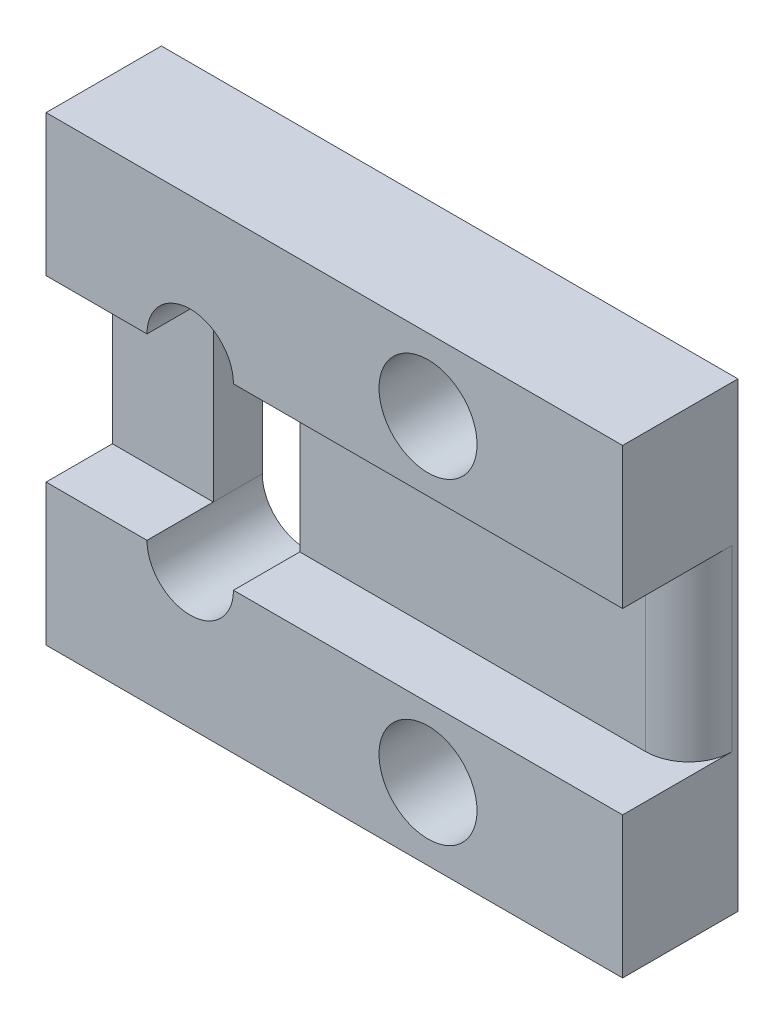
from build123d import *

# Parameters (mm, degrees)
SKETCH1_W            = 20
SKETCH1_H            = 16
BOSS_EXTRUDE1_DEPTH  = 4
M3_CLEARANCE_HOLE1_D = 3.4
SKETCH4_W            = 27.686396546
SKETCH4_H            = 6.2
CUT_EXTRUDE1_DEPTH   = 2.3
FILLET1_R            = 1.5


with BuildPart() as part:
    # Sketch1 → Boss-Extrude1 (new body)
    with BuildSketch(Plane.XY):
        with Locations((10, 8)):
            Rectangle(SKETCH1_W, SKETCH1_H)
        with BuildLine():
            Line((6.5, 11.1), (6.5, 4.9))
            ThreePointArc((6.5, 4.9), (5, 3.4), (3.5, 4.9))
            Line((3.5, 4.9), (3.5, 11.1))
            ThreePointArc((3.5, 11.1), (5, 12.6), (6.5, 11.1))
        make_face(mode=Mode.SUBTRACT)
    extrude(amount=BOSS_EXTRUDE1_DEPTH)

    # M3 Clearance Hole1 (through all)
    with Locations(Plane.XY.offset(4)):
        with Locations((13.25, 13.5), (13.25, 2.5)):
            Hole(M3_CLEARANCE_HOLE1_D / 2)

    # Sketch4 → Cut-Extrude1 (cut)
    with BuildSketch(Plane.XY.offset(4)):
        with Locations((12.569554471, 8)):
            Rectangle(SKETCH4_W, SKETCH4_H)
    extrude(amount=-CUT_EXTRUDE1_DEPTH, mode=Mode.SUBTRACT)

    # Fillet1
    fillet1_edges = [part.edges().sort_by_distance(p)[0] for p in [
        (20, 8, 1.7),
    ]]
    fillet(fillet1_edges, radius=FILLET1_R)


solid = part.part
